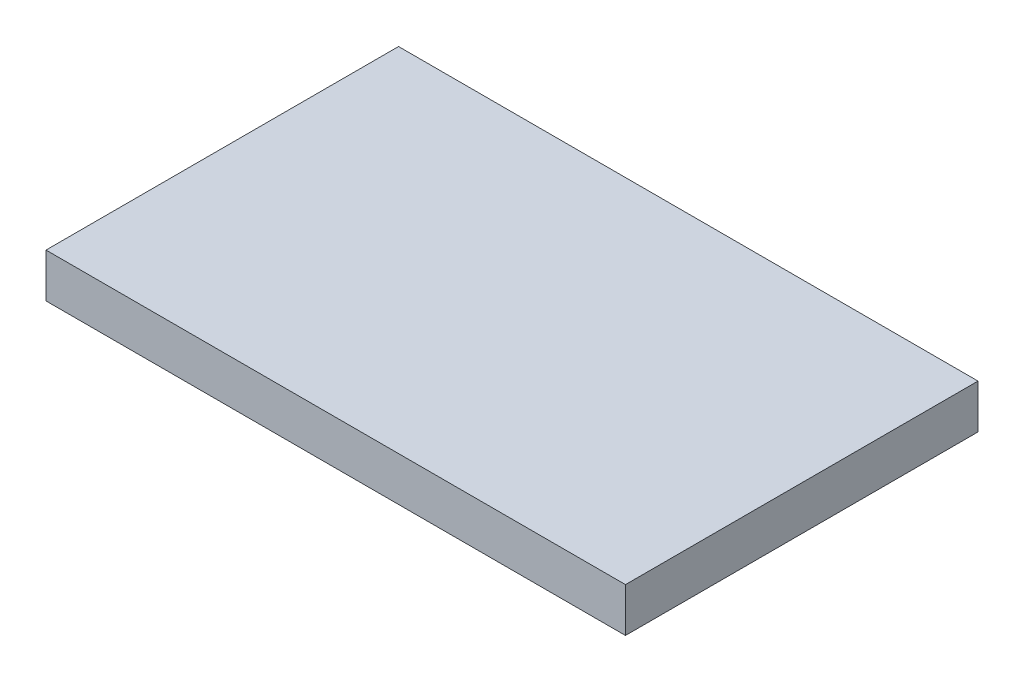
from build123d import *

# Parameters (mm, degrees)
SKETCH1_W           = 83.5
SKETCH1_H           = 50.8
BOSS_EXTRUDE1_DEPTH = 6.35


with BuildPart() as part:
    # Sketch1 → Boss-Extrude1 (new body)
    with BuildSketch(Plane(origin=(0, 0, 0), x_dir=(1, 0, 0), z_dir=(0, 1, 0))):
        with Locations((41.75, 25.4)):
            Rectangle(SKETCH1_W, SKETCH1_H)
    extrude(amount=BOSS_EXTRUDE1_DEPTH)


solid = part.part
